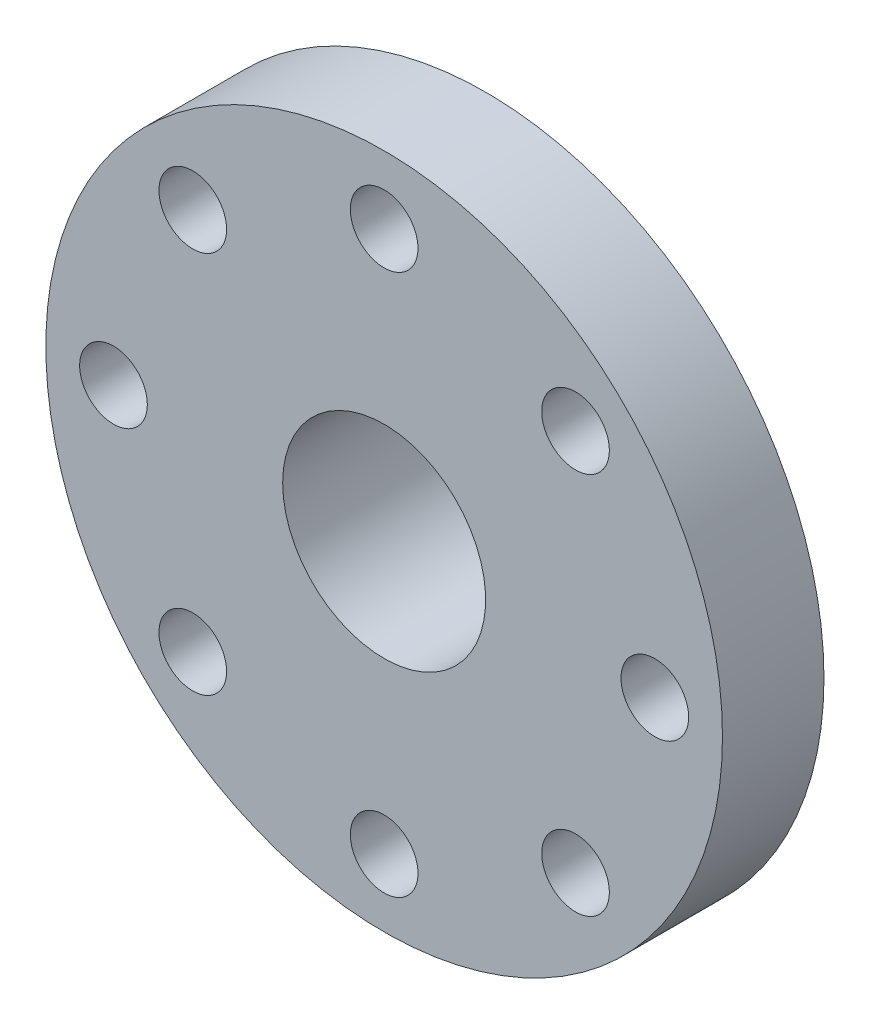
from build123d import *

# Parameters (mm, degrees)
SKETCH_1_R          = 10
SKETCH_1_R_2        = 1.5
SKETCH_1_R_3        = 1
EXTRUDE_1_DEPTH     = 3
SKETCH_2_R          = 5
EXTRUDE_2_DEPTH     = 2
SKETCH_3_R          = 3
CUT_EXTRUDE_1_DEPTH = 16


with BuildPart() as part:
    # 草图1 → 凸台-拉伸1 (new body)
    with BuildSketch(Plane.XY):
        Circle(SKETCH_1_R)
        Circle(SKETCH_1_R_2, mode=Mode.SUBTRACT)
        with Locations((0, 8)):
            Circle(SKETCH_1_R_3, mode=Mode.SUBTRACT)
        with Locations((5.656854249, 5.656854249)):
            Circle(SKETCH_1_R_3, mode=Mode.SUBTRACT)
        with Locations((8, 0)):
            Circle(SKETCH_1_R_3, mode=Mode.SUBTRACT)
        with Locations((5.656854249, -5.656854249)):
            Circle(SKETCH_1_R_3, mode=Mode.SUBTRACT)
        with Locations((0, -8)):
            Circle(SKETCH_1_R_3, mode=Mode.SUBTRACT)
        with Locations((-5.656854249, -5.656854249)):
            Circle(SKETCH_1_R_3, mode=Mode.SUBTRACT)
        with Locations((-8, 0)):
            Circle(SKETCH_1_R_3, mode=Mode.SUBTRACT)
        with Locations((-5.656854249, 5.656854249)):
            Circle(SKETCH_1_R_3, mode=Mode.SUBTRACT)
    extrude(amount=EXTRUDE_1_DEPTH)

    # 草图2 → 凸台-拉伸2 (add)
    with BuildSketch(Plane(origin=(0, 0, 0), x_dir=(-1, 0, 0), z_dir=(0, 0, -1))):
        with Locations(Location((0, 0, 0), (0, 0, 180))):
            Circle(SKETCH_2_R)
    extrude(amount=EXTRUDE_2_DEPTH)

    # 草图3 → 切除-拉伸1 (cut, through all)
    with BuildSketch(Plane(origin=(0, 0, -2), x_dir=(-1, 0, 0), z_dir=(0, 0, -1))):
        Circle(SKETCH_3_R)
    extrude(amount=-CUT_EXTRUDE_1_DEPTH, mode=Mode.SUBTRACT)


solid = part.part
